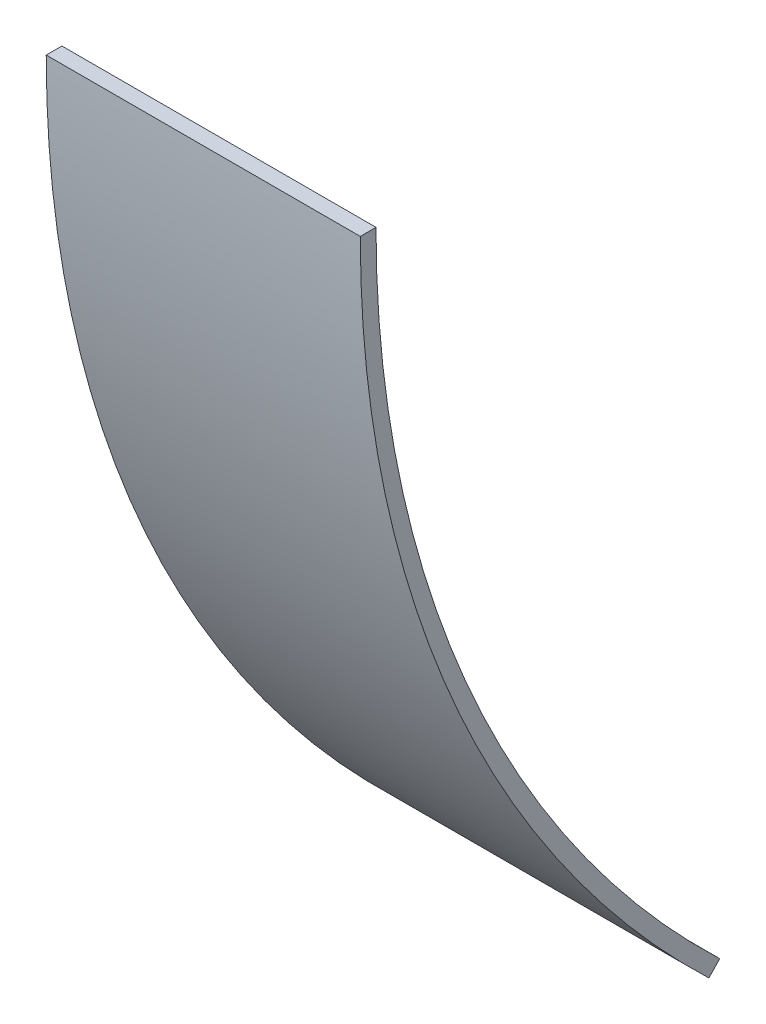
from build123d import *

# Parameters (mm, degrees)
EXTRUDE_THIN1_DEPTH = 31.75


with BuildPart() as part:
    # Sketch1 → Extrude-Thin1 (new, symmetric)
    with BuildSketch(Plane(origin=(0, 0, 0), x_dir=(0, 0, -1), z_dir=(1, 0, 0))):
        with BuildLine():
            ThreePointArc((0, 0), (18.358760574, -89.758460574), (70.486275106, -165.1))
            Line((70.486275106, -165.1), (72.682299062, -162.806944444))
            ThreePointArc((72.682299062, -162.806944444), (21.278777788, -88.511815288), (3.175, 0))
            Line((3.175, 0), (0, 0))
        make_face()
    extrude(amount=EXTRUDE_THIN1_DEPTH, both=True)


solid = part.part
